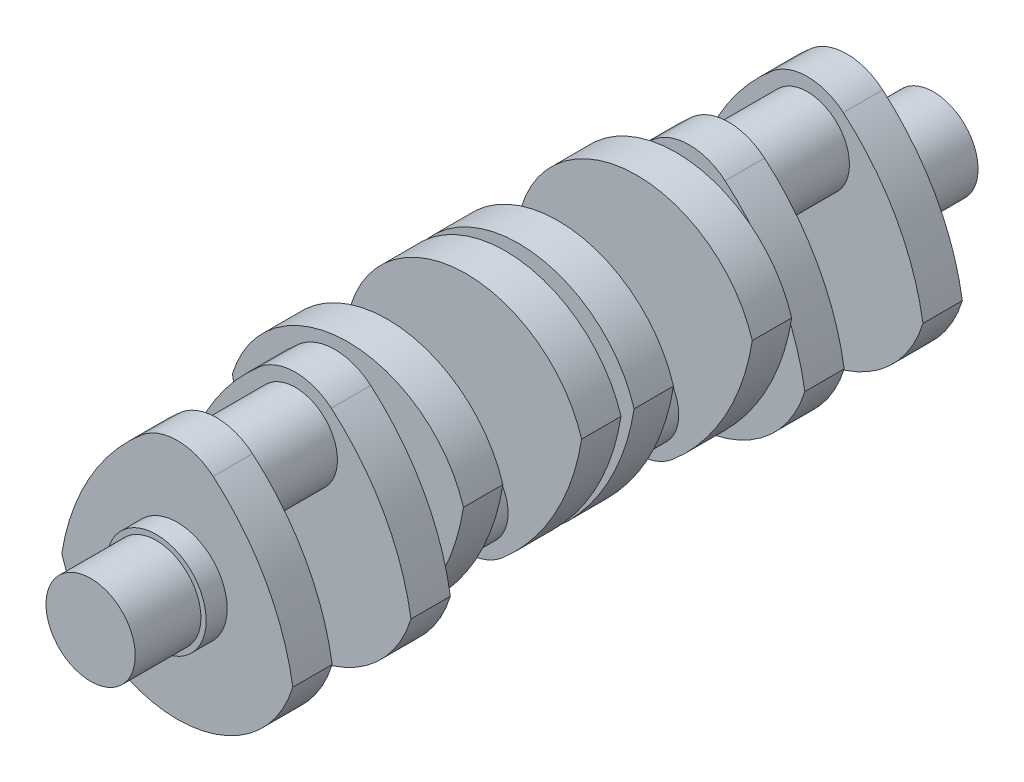
from build123d import *

# Parameters (mm, degrees)
BOSS_EXTRUDE1_DEPTH  = 15
SKETCH2_R            = 16
BOSS_EXTRUDE2_DEPTH  = 15
SKETCH3_R            = 17
BOSS_EXTRUDE3_DEPTH  = 5
BOSS_EXTRUDE4_DEPTH  = 15
SKETCH5_R            = 16
BOSS_EXTRUDE5_DEPTH  = 30
BOSS_EXTRUDE7_DEPTH  = 15
SKETCH7_R            = 17
BOSS_EXTRUDE8_DEPTH  = 2.5
SKETCH8_R            = 19
BOSS_EXTRUDE9_DEPTH  = 8
BOSS_EXTRUDE10_START = 33
SKETCH8_3_R          = 17
BOSS_EXTRUDE10_DEPTH = 25


with BuildPart() as part:
    # Sketch1 → Boss-Extrude1 (new body)
    with BuildSketch(Plane.XY):
        with BuildLine():
            ThreePointArc((-13.668094758, 40.943123461), (0, 46), (13.668094758, 40.943123461))
            ThreePointArc((13.668094758, 40.943123461), (33.683444249, 16.469257624), (44, -13.416407865))
            ThreePointArc((44, -13.416407865), (0, -46), (-44, -13.416407865))
            ThreePointArc((-44, -13.416407865), (-33.683444249, 16.469257624), (-13.668094758, 40.943123461))
        make_face()
    boss_extrude1 = extrude(amount=BOSS_EXTRUDE1_DEPTH)

    # Sketch2 → Boss-Extrude2 (add)
    with BuildSketch(Plane.XY.offset(15)):
        with Locations((0, 25)):
            Circle(SKETCH2_R)
    boss_extrude2 = extrude(amount=BOSS_EXTRUDE2_DEPTH)

    # Mirror4: Boss-Extrude2 across plane
    add(boss_extrude2.mirror(Plane.XY.offset(30)))

    # Mirror5: Boss-Extrude1 across plane
    add(boss_extrude1.mirror(Plane.XY.offset(30)))

    # Sketch3 → Boss-Extrude3 (add)
    with BuildSketch(Plane.XY.offset(60)):
        Circle(SKETCH3_R)
    extrude(amount=BOSS_EXTRUDE3_DEPTH)

    # Sketch4 → Boss-Extrude4 (add)
    with BuildSketch(Plane.XY.offset(65)):
        with BuildLine():
            ThreePointArc((13.668094758, -40.943123461), (33.683444249, -16.469257624), (44, 13.416407865))
            ThreePointArc((44, 13.416407865), (0, 46), (-44, 13.416407865))
            ThreePointArc((-44, 13.416407865), (-33.683444249, -16.469257624), (-13.668094758, -40.943123461))
            ThreePointArc((-13.668094758, -40.943123461), (0, -46), (13.668094758, -40.943123461))
        make_face()
    extrude(amount=BOSS_EXTRUDE4_DEPTH)

    # Sketch5 → Boss-Extrude5 (add)
    with BuildSketch(Plane.XY.offset(80)):
        with Locations((0, -25)):
            Circle(SKETCH5_R)
    extrude(amount=BOSS_EXTRUDE5_DEPTH)

    # Sketch6 → Boss-Extrude7 (add)
    with BuildSketch(Plane.XY.offset(110)):
        with BuildLine():
            ThreePointArc((-13.668094758, -40.943123461), (0, -46), (13.668094758, -40.943123461))
            ThreePointArc((13.668094758, -40.943123461), (33.683444249, -16.469257624), (44, 13.416407865))
            ThreePointArc((44, 13.416407865), (0, 46), (-44, 13.416407865))
            ThreePointArc((-44, 13.416407865), (-33.683444249, -16.469257624), (-13.668094758, -40.943123461))
        make_face()
    extrude(amount=BOSS_EXTRUDE7_DEPTH)

    # Sketch7 → Boss-Extrude8 (add)
    with BuildSketch(Plane.XY.offset(125)):
        Circle(SKETCH7_R)
    extrude(amount=BOSS_EXTRUDE8_DEPTH)

    # Sketch8 → Boss-Extrude9 (add)
    with BuildSketch(Plane(origin=(0, 0, 0), x_dir=(-1, 0, 0), z_dir=(0, 0, -1))):
        Circle(SKETCH8_R)
    extrude(amount=BOSS_EXTRUDE9_DEPTH)

    # Sketch8<3> → Boss-Extrude10 (add)
    with BuildSketch(Plane(origin=(0, 0, 0), x_dir=(-1, 0, 0), z_dir=(0, 0, -1)).offset(BOSS_EXTRUDE10_START)):
        Circle(SKETCH8_3_R)
    extrude(amount=-BOSS_EXTRUDE10_DEPTH)

    # Mirror6: part across plane


with BuildPart() as part_1:
    add(part.part)
    add(part.part.mirror(Plane.XY.offset(127.5)))


solid = part_1.part
